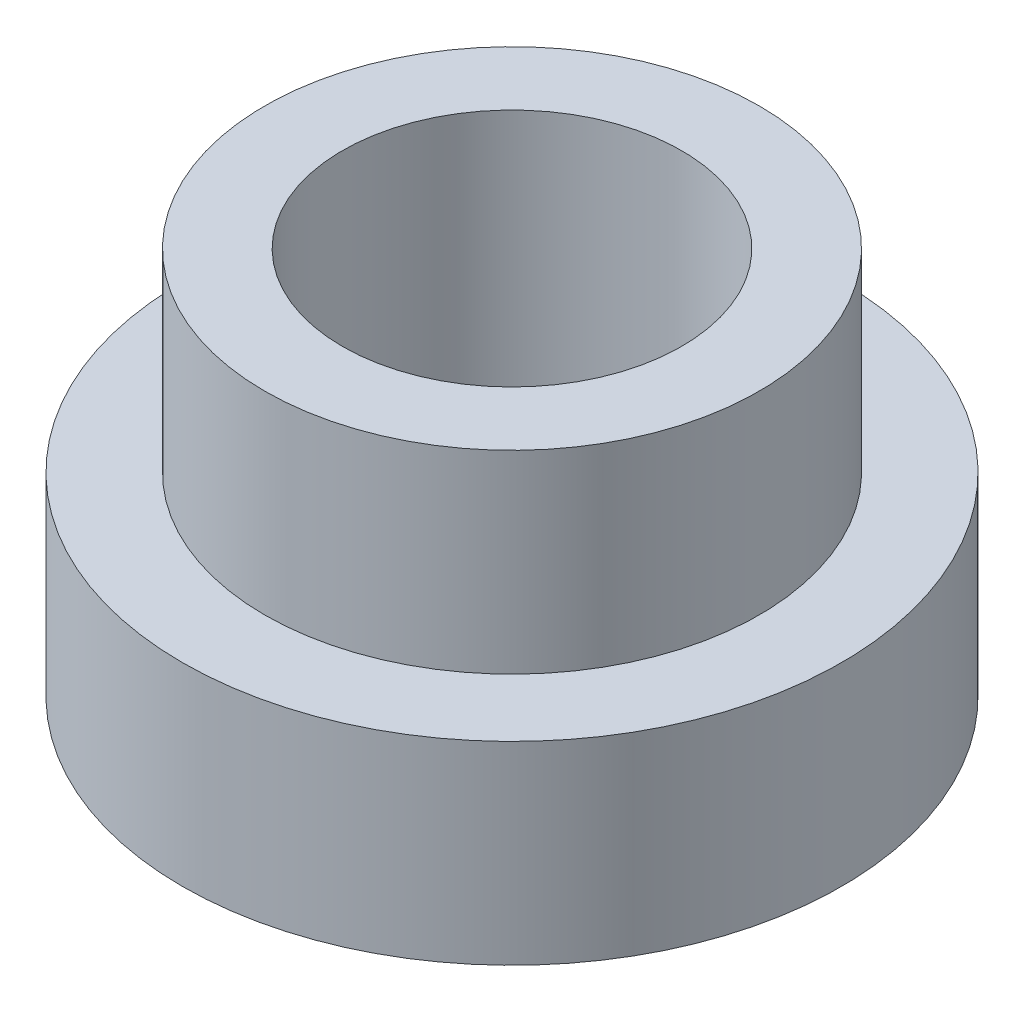
from build123d import *


with BuildPart() as part:
    # Skica1 → Rotovat1 (revolve)
    with BuildSketch(Plane.XY, mode=Mode.PRIVATE) as rotovat1_sk:
        Polygon((-3.4, 0), (-1.75, 0), (-1.75, 4), (-2.55, 4), (-2.55, 2), (-3.4, 2), align=None)
    revolve(rotovat1_sk.sketch.rotate(Axis((0, 4, 0), (0, -1, 0)), 270), axis=Axis((0, 4, 0), (0, -1, 0)))


solid = part.part
